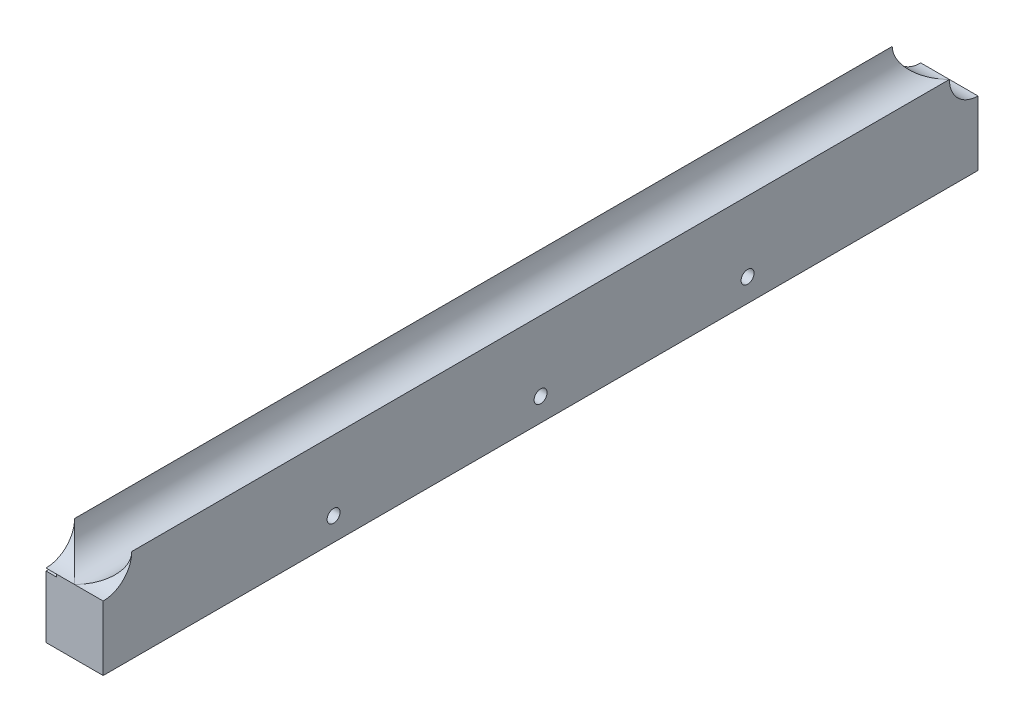
from build123d import *

# Parameters (mm, degrees)
SKETCH1_W             = 22.1
SKETCH1_H             = 338.1
BOSS_EXTRUDE1_DEPTH   = 36
CUT_EXTRUDE1_REACH    = 342.191
SKETCH2_R             = 11.05
SKETCH3_R             = 11.05
CUT_EXTRUDE2_DEPTH    = 175.247847906
F_5_0MM_DOWEL_HOLE4_D = 5
SKETCH16_W            = 4
SKETCH16_H            = 1
CUT_EXTRUDE3_DEPTH    = 341.190700196
SKETCH19_R            = 2.5
CUT_EXTRUDE4_DEPTH    = 10


with BuildPart() as part:
    # Sketch1 → Boss-Extrude1 (new body)
    with BuildSketch(Plane(origin=(0, 0, 0), x_dir=(1, 0, 0), z_dir=(0, 1, 0))):
        Rectangle(SKETCH1_W, SKETCH1_H)
    extrude(amount=BOSS_EXTRUDE1_DEPTH)

    # Sketch2 → Cut-Extrude1 (cut, up to next)
    with BuildSketch(Plane.XY.offset(169.05), mode=Mode.PRIVATE) as cut_extrude1_sk1:
        with Locations((0, 36)):
            Circle(SKETCH2_R)
    cut_extrude1_tool1 = extrude(cut_extrude1_sk1.sketch, amount=-CUT_EXTRUDE1_REACH, mode=Mode.PRIVATE) & part.part
    add(cut_extrude1_tool1.solids().sort_by_distance((0, 36, 169.05))[0], mode=Mode.SUBTRACT)

    # Sketch3 → Cut-Extrude2 (cut, through all)
    with BuildSketch(Plane(origin=(11.05, 0, 0), x_dir=(0, 0, -1), z_dir=(1, 0, 0))):
        with Locations((-169.05, 36)):
            Circle(SKETCH3_R)
        with Locations((169.05, 36)):
            Circle(SKETCH3_R)
    extrude(amount=-CUT_EXTRUDE2_DEPTH, mode=Mode.SUBTRACT)

    # Ø5.0mm Dowel Hole4 (through all)
    with Locations(Plane(origin=(11.05, 0, 0), x_dir=(0, 0, -1), z_dir=(1, 0, 0))):
        with Locations((-80, 8.94), (0, 8.94), (80, 8.94)):
            Hole(F_5_0MM_DOWEL_HOLE4_D / 2)

    # Sketch16 → Cut-Extrude3 (cut, through all)
    with BuildSketch(Plane(origin=(0, 0, -169.05), x_dir=(-1, 0, 0), z_dir=(0, 0, -1))):
        with Locations((9.05, 24.45)):
            Rectangle(SKETCH16_W, SKETCH16_H)
    extrude(amount=-CUT_EXTRUDE3_DEPTH, mode=Mode.SUBTRACT)

    # Sketch19 → Cut-Extrude4 (cut)
    with BuildSketch(Plane(origin=(0, 0, -169.05), x_dir=(-1, 0, 0), z_dir=(0, 0, -1))):
        with Locations((-5.525, 17.9625)):
            Circle(SKETCH19_R)
        with Locations((5.525, 5.9875)):
            Circle(SKETCH19_R)
    extrude(amount=-CUT_EXTRUDE4_DEPTH, mode=Mode.SUBTRACT)


solid = part.part
